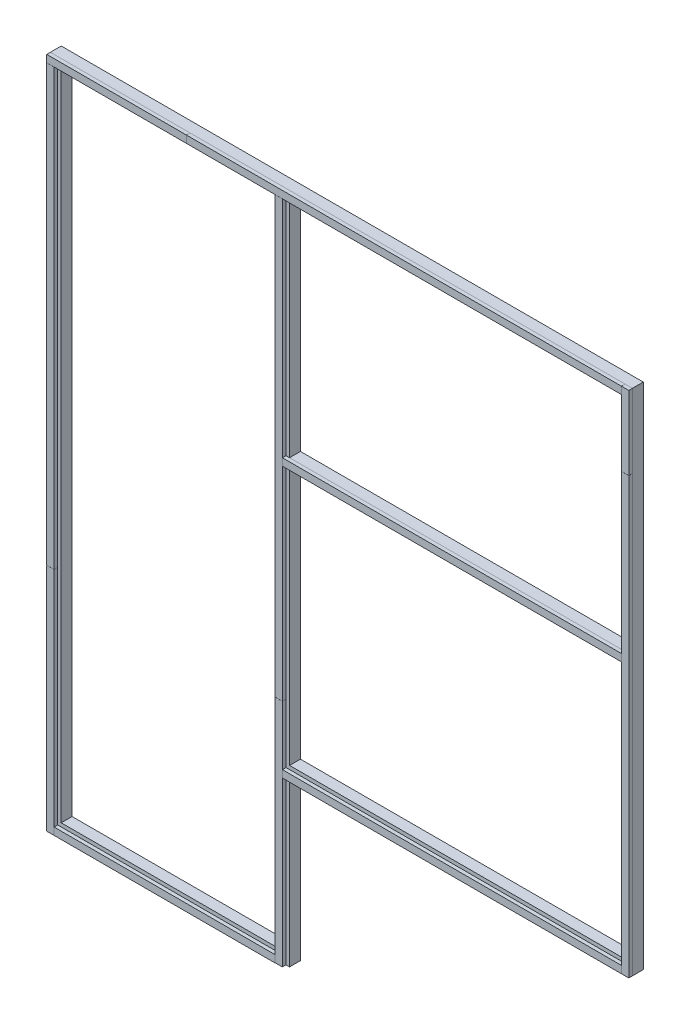
from build123d import *

# Parameters (mm, degrees)
SKETCH_1_W         = 2999
SKETCH_1_H         = 8978
SKETCH_1_W_2       = 4578
SKETCH_1_H_2       = 3043
SKETCH_1_H_3       = 3525
EXTRUDE_1_DEPTH    = 150
SKETCH_2_W         = 100
SKETCH_2_H         = 6000
EXTRUDE_2_DEPTH    = 50
SKETCH_2_H_2       = 1017
EXTRUDE_2_2_DEPTH  = 50
SKETCH_2_W_2       = 6000
SKETCH_2_H_3       = 100
EXTRUDE_2_3_DEPTH  = 50
SKETCH_2_W_3       = 1925
EXTRUDE_2_4_DEPTH  = 50
EXTRUDE_2_5_DEPTH  = 50
EXTRUDE_2_6_DEPTH  = 50
SKETCH_2_H_4       = 3173.045468324
EXTRUDE_2_7_DEPTH  = 50
SKETCH_2_H_5       = 3175.909063353
EXTRUDE_2_8_DEPTH  = 50
SKETCH_2_W_4       = 3047
EXTRUDE_2_9_DEPTH  = 50
SKETCH_2_W_5       = 4676
EXTRUDE_2_10_DEPTH = 50
EXTRUDE_2_11_DEPTH = 50


with BuildPart() as part:
    # Эскиз1 → Бобышка-Вытянуть1 (new body)
    with BuildSketch(Plane.XY):
        Polygon((50, -50), (8077, -50), (8077, -7068), (3349, -7068), (3349, -9325), (50, -9328), align=None)
        with Locations((1699.5, -4689)):
            Rectangle(SKETCH_1_W, SKETCH_1_H, mode=Mode.SUBTRACT)
        with Locations((5638, -1721.5)):
            Rectangle(SKETCH_1_W_2, SKETCH_1_H_2, mode=Mode.SUBTRACT)
        with Locations((5638, -5155.5)):
            Rectangle(SKETCH_1_W_2, SKETCH_1_H_3, mode=Mode.SUBTRACT)
    extrude(amount=EXTRUDE_1_DEPTH)


with BuildPart() as body_2:
    # Эскиз2 → Бобышка-Вытянуть2 (new body)
    with BuildSketch(Plane.XY.offset(150)):
        with Locations((8027, -4068)):
            Rectangle(SKETCH_2_W, SKETCH_2_H)
    extrude(amount=EXTRUDE_2_DEPTH)


with BuildPart() as body_3:
    # Эскиз2 → Extrude 2 2 (new body)
    with BuildSketch(Plane.XY.offset(150)):
        with Locations((8027, -558.5)):
            Rectangle(SKETCH_2_W, SKETCH_2_H_2)
    extrude(amount=EXTRUDE_2_2_DEPTH)


with BuildPart() as body_4:
    # Эскиз2 → Extrude 2 3 (new body)
    with BuildSketch(Plane.XY.offset(150)):
        with Locations((4976, -100)):
            Rectangle(SKETCH_2_W_2, SKETCH_2_H_3)
    extrude(amount=EXTRUDE_2_3_DEPTH)


with BuildPart() as body_5:
    # Эскиз2 → Extrude 2 4 (new body)
    with BuildSketch(Plane.XY.offset(150)):
        with Locations((1012.5, -100)):
            Rectangle(SKETCH_2_W_3, SKETCH_2_H_3)
    extrude(amount=EXTRUDE_2_4_DEPTH)


with BuildPart() as body_6:
    # Эскиз2 → Extrude 2 5 (new body)
    with BuildSketch(Plane.XY.offset(150)):
        with Locations((100, -3151)):
            Rectangle(SKETCH_2_W, SKETCH_2_H)
    extrude(amount=EXTRUDE_2_5_DEPTH)


with BuildPart() as body_7:
    # Эскиз2 → Extrude 2 6 (new body)
    with BuildSketch(Plane.XY.offset(150)):
        with Locations((3249, -3151)):
            Rectangle(SKETCH_2_W, SKETCH_2_H)
    extrude(amount=EXTRUDE_2_6_DEPTH)


with BuildPart() as body_8:
    # Эскиз2 → Extrude 2 7 (new body)
    with BuildSketch(Plane.XY.offset(150)):
        with Locations((3249, -7738.522734162)):
            Rectangle(SKETCH_2_W, SKETCH_2_H_4)
    extrude(amount=EXTRUDE_2_7_DEPTH)


with BuildPart() as body_9:
    # Эскиз2 → Extrude 2 8 (new body)
    with BuildSketch(Plane.XY.offset(150)):
        with Locations((100, -7739.954531677)):
            Rectangle(SKETCH_2_W, SKETCH_2_H_5)
    extrude(amount=EXTRUDE_2_8_DEPTH)


with BuildPart() as body_10:
    # Эскиз2 → Extrude 2 9 (new body)
    with BuildSketch(Plane.XY.offset(150)):
        with Locations((1674.5, -9277.908153986)):
            Rectangle(SKETCH_2_W_4, SKETCH_2_H_3)
    extrude(amount=EXTRUDE_2_9_DEPTH)


with BuildPart() as body_11:
    # Эскиз2 → Extrude 2 10 (new body)
    with BuildSketch(Plane.XY.offset(150)):
        with Locations((5638, -7018)):
            Rectangle(SKETCH_2_W_5, SKETCH_2_H_3)
    extrude(amount=EXTRUDE_2_10_DEPTH)


with BuildPart() as body_12:
    # Эскиз2 → Extrude 2 11 (new body)
    with BuildSketch(Plane.XY.offset(150)):
        with Locations((5638, -3293)):
            Rectangle(SKETCH_2_W_5, SKETCH_2_H_3)
    extrude(amount=EXTRUDE_2_11_DEPTH)


solid = Compound([part.part, body_2.part, body_3.part, body_4.part, body_5.part, body_6.part, body_7.part, body_8.part, body_9.part, body_10.part, body_11.part, body_12.part])
